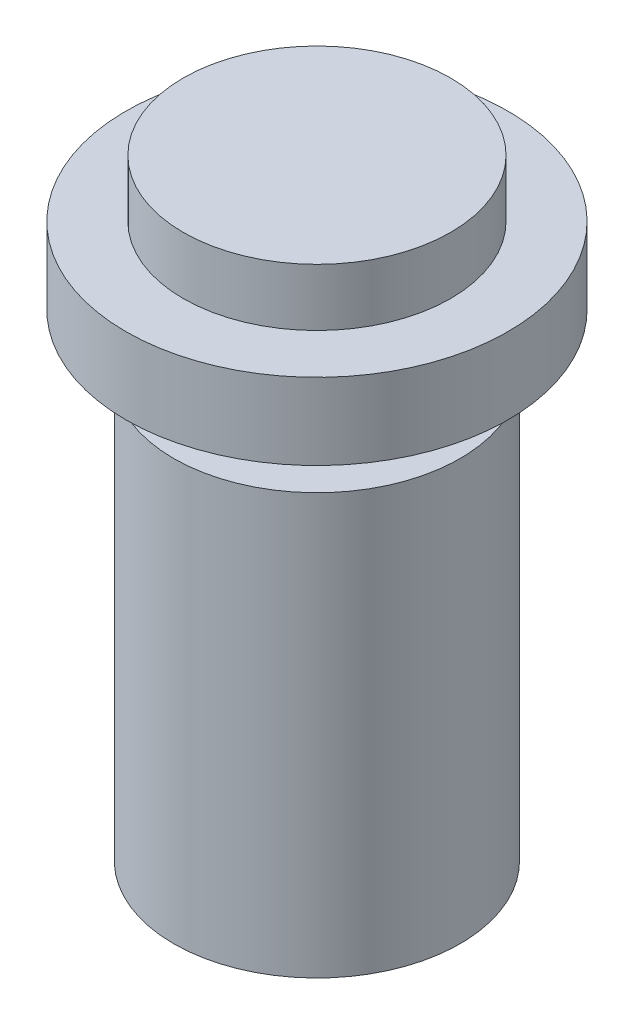
from build123d import *

# Parameters (mm, degrees)
P01_BEZEL_START = 25
SK_P01_BEZEL_R  = 10
P01_BEZEL_DEPTH = 4
P02_LENS_START  = 29
SK_P02_LENS_R   = 7
P02_LENS_DEPTH  = 3
SK_P03_BODY_R   = 7.5
P03_BODY_DEPTH  = 22


with BuildPart() as part:
    # SK_P01_Bezel → P01_Bezel (new body)
    with BuildSketch(Plane(origin=(0, 0, 0), x_dir=(1, 0, 0), z_dir=(0, 1, 0)).offset(P01_BEZEL_START)):
        with Locations(Location((0, 0, 0), (0, 0, 270))):
            Circle(SK_P01_BEZEL_R)
    extrude(amount=P01_BEZEL_DEPTH)

    # SK_P02_Lens → P02_Lens (add)
    with BuildSketch(Plane(origin=(0, 0, 0), x_dir=(1, 0, 0), z_dir=(0, 1, 0)).offset(P02_LENS_START)):
        with Locations(Location((0, 0, 0), (0, 0, 270))):
            Circle(SK_P02_LENS_R)
    extrude(amount=P02_LENS_DEPTH)


with BuildPart() as body_2:
    # SK_P03_Body → P03_Body (new body)
    with BuildSketch(Plane(origin=(0, 0, 0), x_dir=(1, 0, 0), z_dir=(0, 1, 0))):
        with Locations(Location((0, 0, 0), (0, 0, 270))):
            Circle(SK_P03_BODY_R)
    extrude(amount=P03_BODY_DEPTH)


solid = Compound([part.part, body_2.part])
